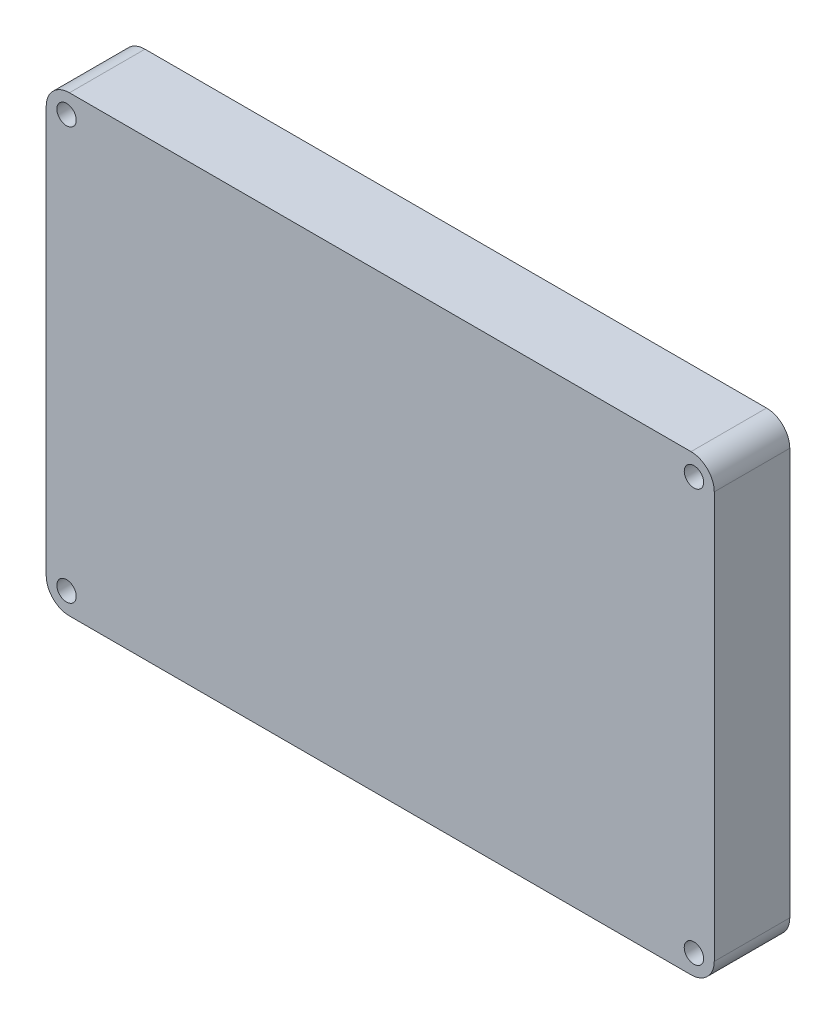
from build123d import *

# Parameters (mm, degrees)
SKETCH1_W           = 115
SKETCH1_H           = 78
SKETCH1_R           = 1.67
BOSS_EXTRUDE1_DEPTH = 13
FILLET1_R           = 4


with BuildPart() as part:
    # Sketch1 → Boss-Extrude1 (new body)
    with BuildSketch(Plane.XY):
        with Locations((-57.5, 39)):
            Rectangle(SKETCH1_W, SKETCH1_H)
        with Locations(Location((-111.5, 74.5, 0), (0, 0, 180))):
            Circle(SKETCH1_R, mode=Mode.SUBTRACT)
        with Locations(Location((-3.5, 74.5, 0), (0, 0, 180))):
            Circle(SKETCH1_R, mode=Mode.SUBTRACT)
        with Locations(Location((-3.5, 3.5, 0), (0, 0, 180))):
            Circle(SKETCH1_R, mode=Mode.SUBTRACT)
        with Locations(Location((-111.5, 3.5, 0), (0, 0, 180))):
            Circle(SKETCH1_R, mode=Mode.SUBTRACT)
    extrude(amount=BOSS_EXTRUDE1_DEPTH)

    # Fillet1
    fillet1_edges = [part.edges().sort_by_distance(p)[0] for p in [
        (-115, 78, 6.5),
        (0, 78, 6.5),
        (0, 0, 6.5),
        (-115, 0, 6.5),
    ]]
    fillet(fillet1_edges, radius=FILLET1_R)


solid = part.part
